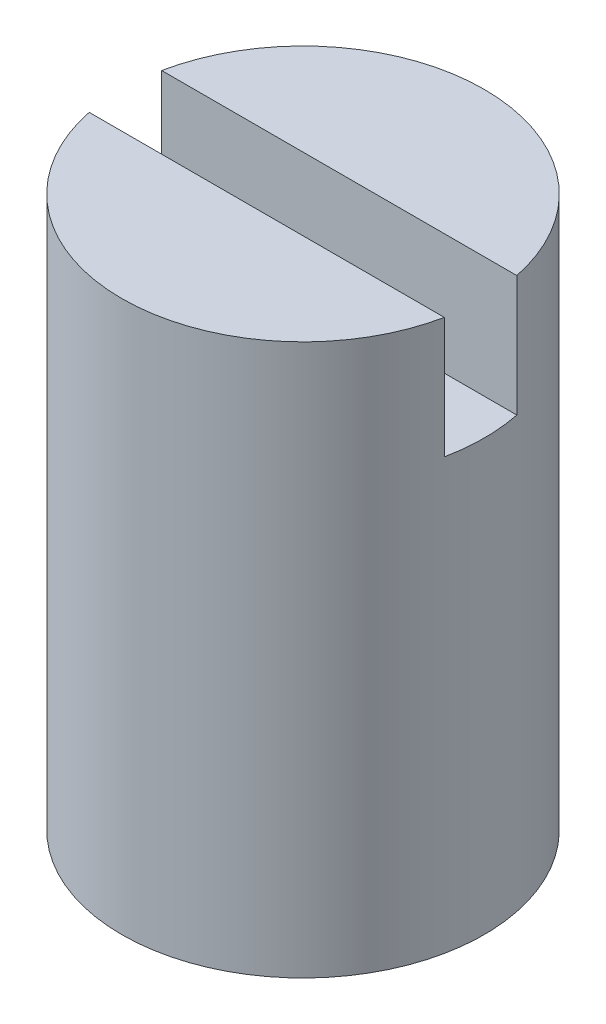
from build123d import *

# Parameters (mm, degrees)
SKETCH1_R           = 4.7625
BOSS_EXTRUDE1_DEPTH = 14.478
SKETCH2_W           = 9.525
SKETCH2_H           = 1.905
CUT_EXTRUDE1_DEPTH  = 3.175
SKETCH3_R           = 1.999996
CUT_EXTRUDE2_DEPTH  = 5


with BuildPart() as part:
    # Sketch1 → Boss-Extrude1 (new body)
    with BuildSketch(Plane(origin=(0, 0, 0), x_dir=(1, 0, 0), z_dir=(0, 1, 0))):
        with Locations(Location((0, 0, 0), (0, 0, 270))):
            Circle(SKETCH1_R)
    extrude(amount=-BOSS_EXTRUDE1_DEPTH)

    # Sketch2 → Cut-Extrude1 (cut)
    with BuildSketch(Plane(origin=(0, 0, 0), x_dir=(1, 0, 0), z_dir=(0, 1, 0))):
        Rectangle(SKETCH2_W, SKETCH2_H)
    extrude(amount=-CUT_EXTRUDE1_DEPTH, mode=Mode.SUBTRACT)

    # Sketch3 → Cut-Extrude2 (cut)
    with BuildSketch(Plane.XZ.offset(14.478)):
        with Locations(Location((0, 0, 0), (0, 0, 270))):
            Circle(SKETCH3_R)
    extrude(amount=-CUT_EXTRUDE2_DEPTH, mode=Mode.SUBTRACT)


solid = part.part
